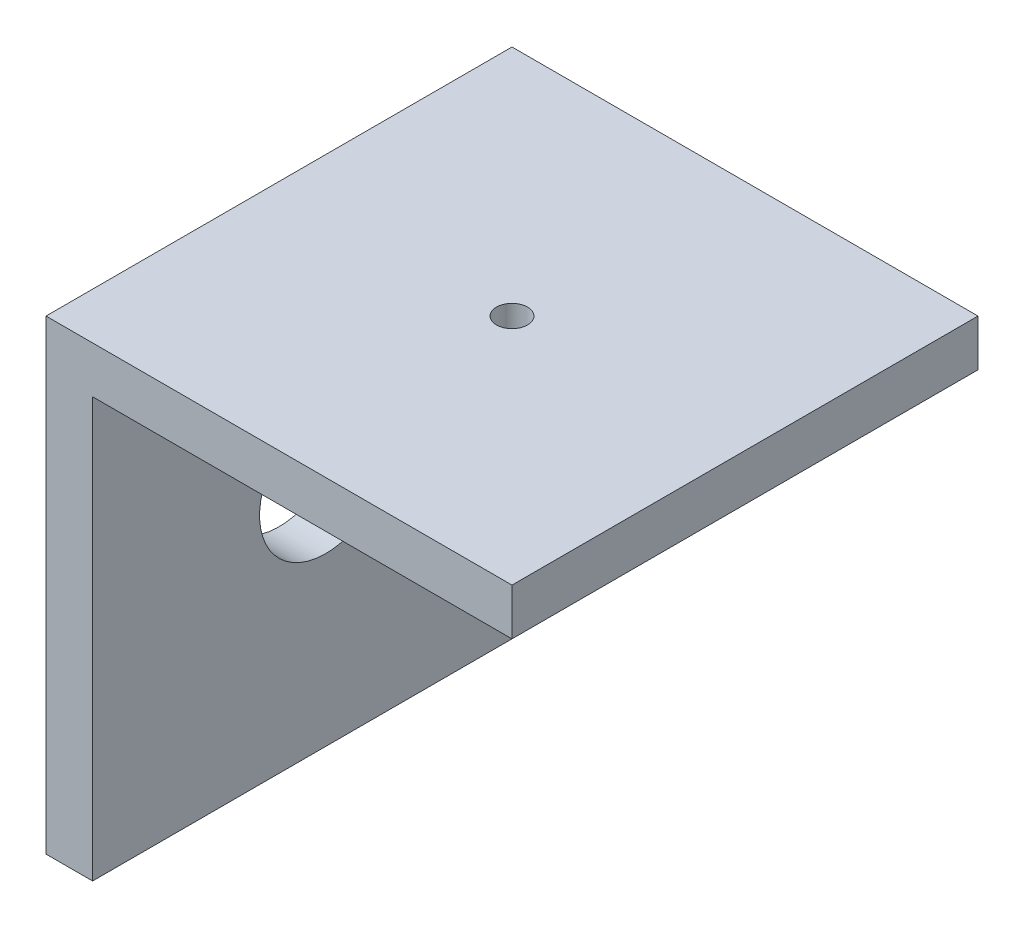
from build123d import *

# Parameters (mm, degrees)
EXTRUDE_1_DEPTH     = 15
SKETCH_3_R          = 4.25
CUT_EXTRUDE_1_DEPTH = 44.058100283
SKETCH_5_R          = 1
CUT_EXTRUDE_2_DEPTH = 46


with BuildPart() as part:
    # 草图1 → 凸台-拉伸1 (new, symmetric)
    with BuildSketch(Plane.XY):
        Polygon((0, -30), (0, 0), (30, 0), (30, -3), (3, -3), (3, -30), align=None)
    extrude(amount=EXTRUDE_1_DEPTH, both=True)

    # 草图3 → 切除-拉伸1 (cut, through all)
    with BuildSketch(Plane(origin=(3, 0, 0), x_dir=(0, 0, -1), z_dir=(1, 0, 0))):
        with Locations((0, -15)):
            Circle(SKETCH_3_R)
    extrude(amount=-CUT_EXTRUDE_1_DEPTH, mode=Mode.SUBTRACT)

    # 草图5 → 切除-拉伸2 (cut, through all)
    with BuildSketch(Plane(origin=(0, 0, 0), x_dir=(1, 0, 0), z_dir=(0, 1, 0))):
        with Locations(Location((15, 0, 0), (0, 0, 270))):
            Circle(SKETCH_5_R)
    extrude(amount=-CUT_EXTRUDE_2_DEPTH, mode=Mode.SUBTRACT)


solid = part.part
